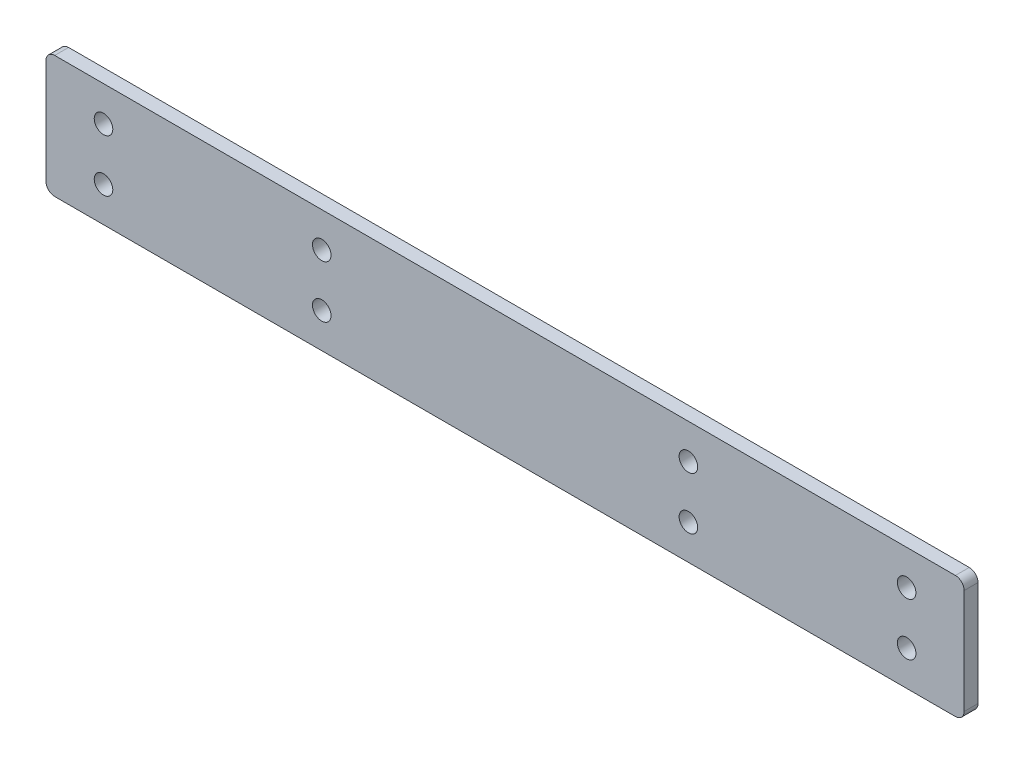
from build123d import *

# Parameters (mm, degrees)
SKETCH1_W           = 210.35
SKETCH1_H           = 28
SKETCH1_R           = 2.125
BOSS_EXTRUDE1_DEPTH = 3.175
FILLET1_R           = 2


with BuildPart() as part:
    # Sketch1 → Boss-Extrude1 (new body)
    with BuildSketch(Plane.XY):
        Rectangle(SKETCH1_W, SKETCH1_H)
        with Locations((92, 6)):
            Circle(SKETCH1_R, mode=Mode.SUBTRACT)
        with Locations(Location((92, -6, 0), (0, 0, 180))):
            Circle(SKETCH1_R, mode=Mode.SUBTRACT)
        with Locations((-92, -6)):
            Circle(SKETCH1_R, mode=Mode.SUBTRACT)
        with Locations(Location((-92, 6, 0), (0, 0, 180))):
            Circle(SKETCH1_R, mode=Mode.SUBTRACT)
        with Locations((-42, 6)):
            Circle(SKETCH1_R, mode=Mode.SUBTRACT)
        with Locations(Location((-42, -6, 0), (0, 0, 180))):
            Circle(SKETCH1_R, mode=Mode.SUBTRACT)
        with Locations((42, -6)):
            Circle(SKETCH1_R, mode=Mode.SUBTRACT)
        with Locations(Location((42, 6, 0), (0, 0, 180))):
            Circle(SKETCH1_R, mode=Mode.SUBTRACT)
    extrude(amount=BOSS_EXTRUDE1_DEPTH)

    # Fillet1
    fillet1_edges = [part.edges().sort_by_distance(p)[0] for p in [
        (105.175, -14, 1.5875),
        (-105.175, -14, 1.5875),
        (-105.175, 14, 1.5875),
        (105.175, 14, 1.5875),
    ]]
    fillet(fillet1_edges, radius=FILLET1_R)


solid = part.part
